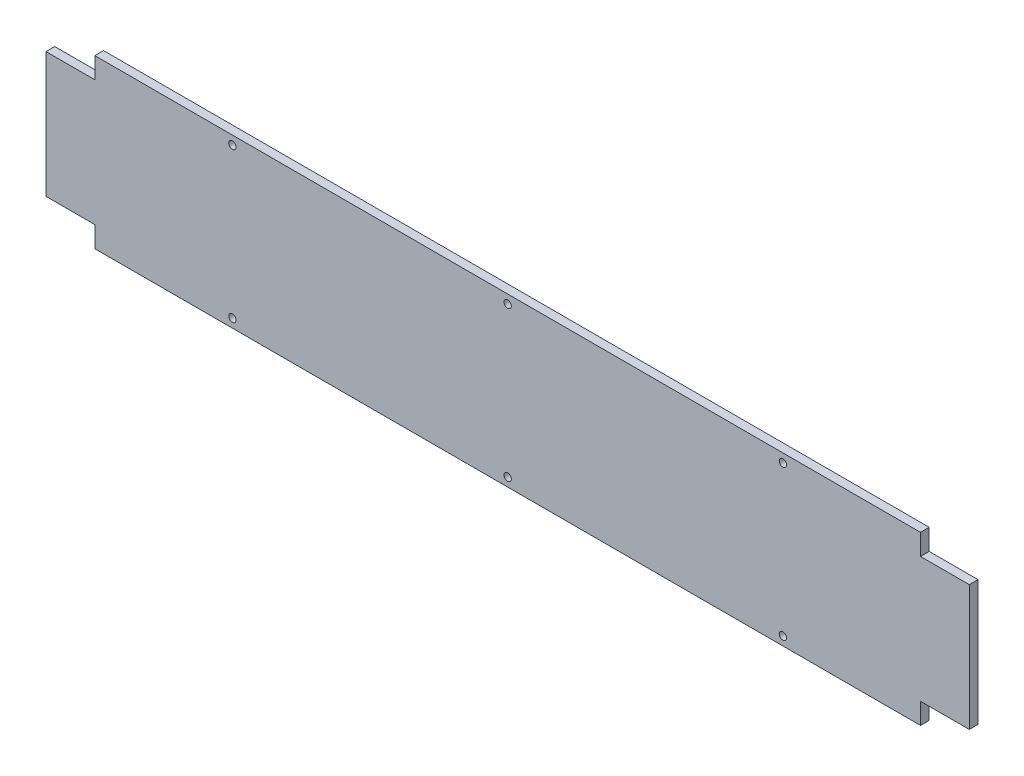
from build123d import *

# Parameters (mm, degrees)
SKETCH1_W           = 474
SKETCH1_H           = 96
BOSS_EXTRUDE1_DEPTH = 5
SKETCH2_R           = 2.1
CUT_EXTRUDE1_DEPTH  = 5
SKETCH3_W           = 28
SKETCH3_H           = 72
BOSS_EXTRUDE2_DEPTH = 5


with BuildPart() as part:
    # Sketch1 → Boss-Extrude1 (new body)
    with BuildSketch(Plane.XY):
        with Locations((237, 48)):
            Rectangle(SKETCH1_W, SKETCH1_H)
    extrude(amount=BOSS_EXTRUDE1_DEPTH)

    # Sketch2 → Cut-Extrude1 (cut)
    with BuildSketch(Plane.XY.offset(5)):
        with Locations((79, 91)):
            Circle(SKETCH2_R)
        with Locations((237, 91)):
            Circle(SKETCH2_R)
        with Locations((395, 91)):
            Circle(SKETCH2_R)
        with Locations(Location((395, 5, 0), (0, 0, 180))):
            Circle(SKETCH2_R)
        with Locations(Location((237, 5, 0), (0, 0, 180))):
            Circle(SKETCH2_R)
        with Locations(Location((79, 5, 0), (0, 0, 180))):
            Circle(SKETCH2_R)
    extrude(amount=-CUT_EXTRUDE1_DEPTH, mode=Mode.SUBTRACT)

    # Sketch3 → Boss-Extrude2 (add)
    with BuildSketch(Plane.XY.offset(5)):
        with Locations((488, 48)):
            Rectangle(SKETCH3_W, SKETCH3_H)
        with Locations((-14, 48)):
            Rectangle(SKETCH3_W, SKETCH3_H)
    extrude(amount=-BOSS_EXTRUDE2_DEPTH)


solid = part.part
